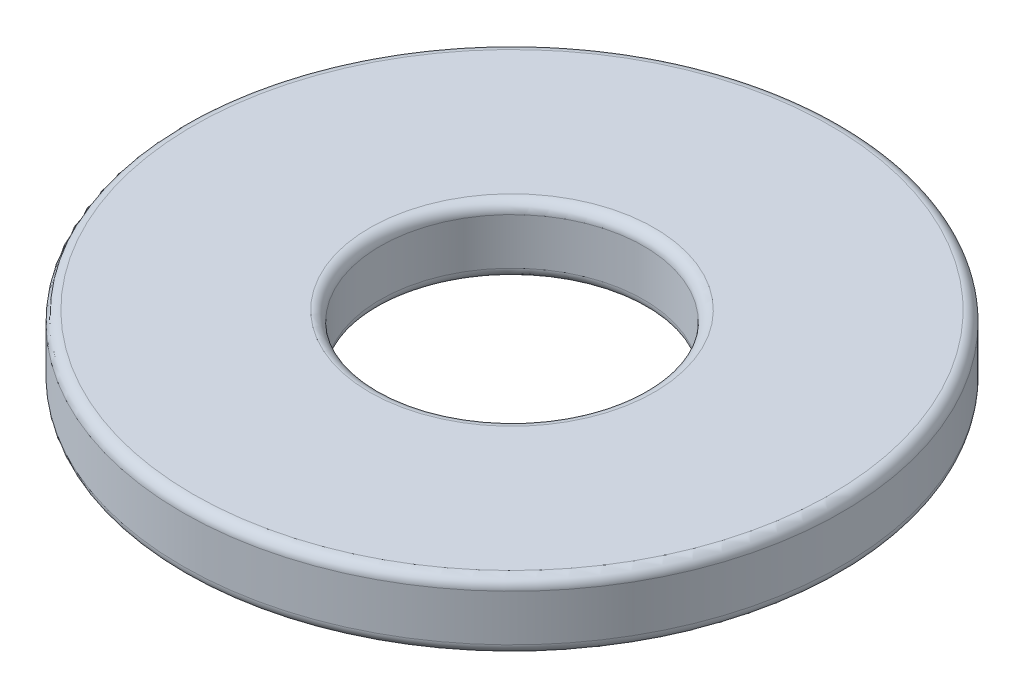
from build123d import *

# Parameters (mm, degrees)
SKETCH1_R           = 3.96875
SKETCH1_R_2         = 1.5875
BOSS_EXTRUDE1_DEPTH = 0.8128
FILLET1_R           = 0.127


with BuildPart() as part:
    # Sketch1 → Boss-Extrude1 (new body)
    with BuildSketch(Plane(origin=(0, 0, 0), x_dir=(1, 0, 0), z_dir=(0, 1, 0))):
        with Locations(Location((0, 0, 0), (0, 0, 270))):
            Circle(SKETCH1_R)
        with Locations(Location((0, 0, 0), (0, 0, 270))):
            Circle(SKETCH1_R_2, mode=Mode.SUBTRACT)
    extrude(amount=BOSS_EXTRUDE1_DEPTH)

    # Fillet1
    fillet1_edges = [part.edges().sort_by_distance(p)[0] for p in [
        (0, 0, -3.96875),
        (0, 0.8128, -3.96875),
        (0, 0, -1.5875),
        (0, 0.8128, -1.5875),
    ]]
    fillet(fillet1_edges, radius=FILLET1_R)


solid = part.part
